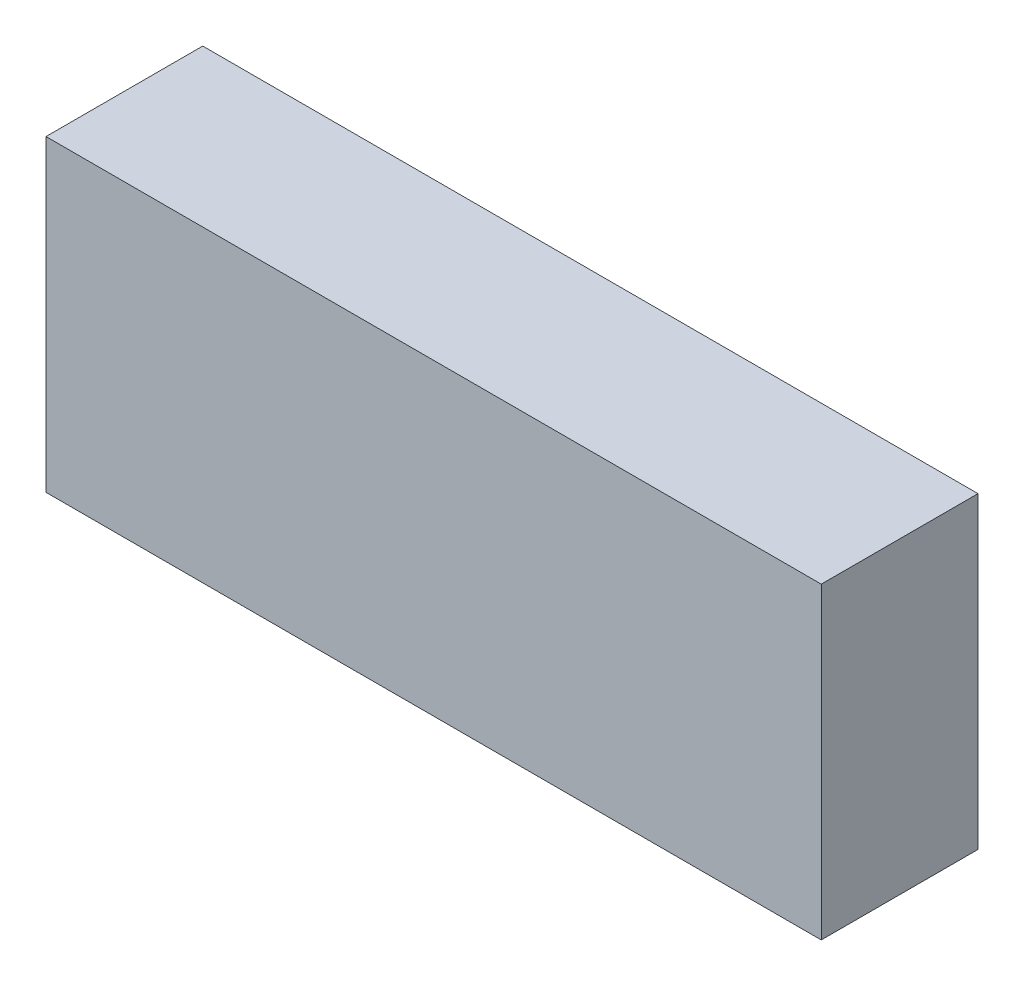
from build123d import *

# Parameters (mm, degrees)
SKIZZE1_W               = 4.946
SKIZZE1_H               = 1.966
COMPONENT_OUTLINE_DEPTH = 1


with BuildPart() as part:
    # Skizze1 → Component_Outline (new body)
    with BuildSketch(Plane.XY):
        Rectangle(SKIZZE1_W, SKIZZE1_H)
    extrude(amount=COMPONENT_OUTLINE_DEPTH)


solid = part.part
